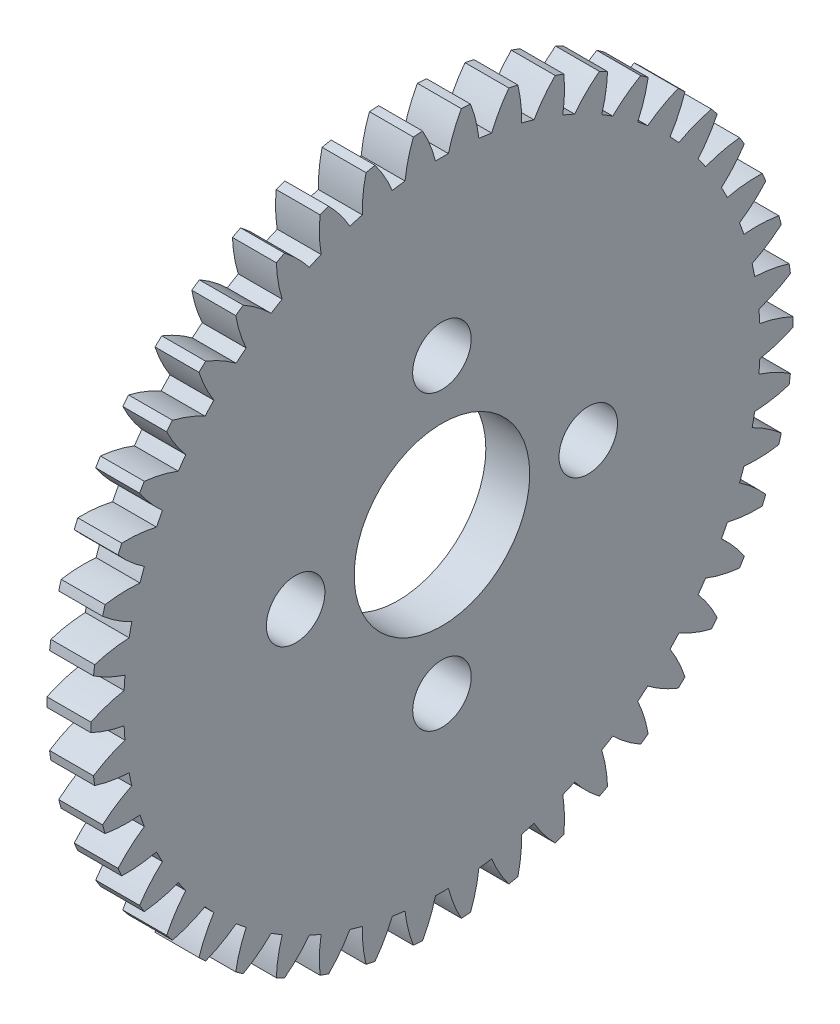
from build123d import *

# Parameters (mm, degrees)
BASPROSKE_W        = 1.5
BASPROSKE_H        = 12
TOOTHCUT_DEPTH     = 18.036725037
TEETHCUTS_COUNT    = 46
TEETHCUTS_ANGLE    = 352.173913043
HUBNEAONESKE_R     = 2.3
HUBNEARONE_DEPTH   = 1.9000508
BORSKE_R           = 1
BORE_DEPTH         = 3.4000508
SKETCH1_R          = 3
CUT_EXTRUDE1_DEPTH = 18.29513913
SKETCH2_R          = 1
CUT_EXTRUDE2_DEPTH = 18.023850683
CIRPATTERN1_COUNT  = 4


with BuildPart() as part:
    # BasProSke → Base-Revolve (revolve)
    with BuildSketch(Plane(origin=(0, 0, 0), x_dir=(1, 0, 0), z_dir=(0, 1, 0)), mode=Mode.PRIVATE) as base_revolve_sk:
        with Locations((0.75, 6)):
            Rectangle(BASPROSKE_W, BASPROSKE_H)
    revolve(base_revolve_sk.sketch.rotate(Axis((-10, 0, 0), (1, 0, 0)), 180), axis=Axis((-10, 0, 0), (1, 0, 0)))

    # TooCutSke → ToothCut (cut, through all)
    with BuildSketch(Plane(origin=(0, 0, 0), x_dir=(0, 0, -1), z_dir=(1, 0, 0))):
        with BuildLine():
            ThreePointArc((0.220637229, 10.871761367), (0, 10.874), (-0.220637229, 10.871761367))
            ThreePointArc((-0.220637229, 10.871761367), (-0.410484473, 11.454269177), (-0.676058609, 12.006381217))
            ThreePointArc((-0.676058609, 12.006381217), (0, 12.0254), (0.676058609, 12.006381217))
            ThreePointArc((0.676058609, 12.006381217), (0.410484473, 11.454269177), (0.220637229, 10.871761367))
        make_face()
    toothcut = extrude(amount=TOOTHCUT_DEPTH, mode=Mode.SUBTRACT)

    # TeethCuts: ToothCut ×46 about axis
    teethcuts_axis = Axis((-10, 0, 0), (1, 0, 0))
    for i in range(1, TEETHCUTS_COUNT):
        add(toothcut.rotate(teethcuts_axis, i * TEETHCUTS_ANGLE / (TEETHCUTS_COUNT - 1)), mode=Mode.SUBTRACT)

    # HubNeaOneSke → HubNearOne (add)
    with BuildSketch(Plane.ZY):
        with Locations(Location((0, 0, 0), (0, 0, 180))):
            Circle(HUBNEAONESKE_R)
    extrude(amount=HUBNEARONE_DEPTH)

    # BorSke → Bore (cut, symmetric)
    with BuildSketch(Plane(origin=(0, 0, 0), x_dir=(0, 0, -1), z_dir=(1, 0, 0))):
        with Locations(Location((0, 0, 0), (0, 0, 180))):
            Circle(BORSKE_R)
    extrude(amount=BORE_DEPTH, both=True, mode=Mode.SUBTRACT)

    # Sketch1 → Cut-Extrude1 (cut, through all)
    with BuildSketch(Plane(origin=(1.5, 0, 0), x_dir=(0, 0, -1), z_dir=(1, 0, 0))):
        Circle(SKETCH1_R)
    extrude(amount=-CUT_EXTRUDE1_DEPTH, mode=Mode.SUBTRACT)

    # Sketch2 → Cut-Extrude2 (cut, through all)
    with BuildSketch(Plane(origin=(1.5, 0, 0), x_dir=(0, 0, -1), z_dir=(1, 0, 0))):
        with Locations((0, 5)):
            Circle(SKETCH2_R)
    cut_extrude2 = extrude(amount=-CUT_EXTRUDE2_DEPTH, mode=Mode.SUBTRACT)

    # CirPattern1: Cut-Extrude2 ×4 about axis
    cirpattern1_axis = Axis((0, 0, 0), (1, 0, 0))
    for i in range(1, CIRPATTERN1_COUNT):
        add(cut_extrude2.rotate(cirpattern1_axis, i * 360 / CIRPATTERN1_COUNT), mode=Mode.SUBTRACT)


solid = part.part
